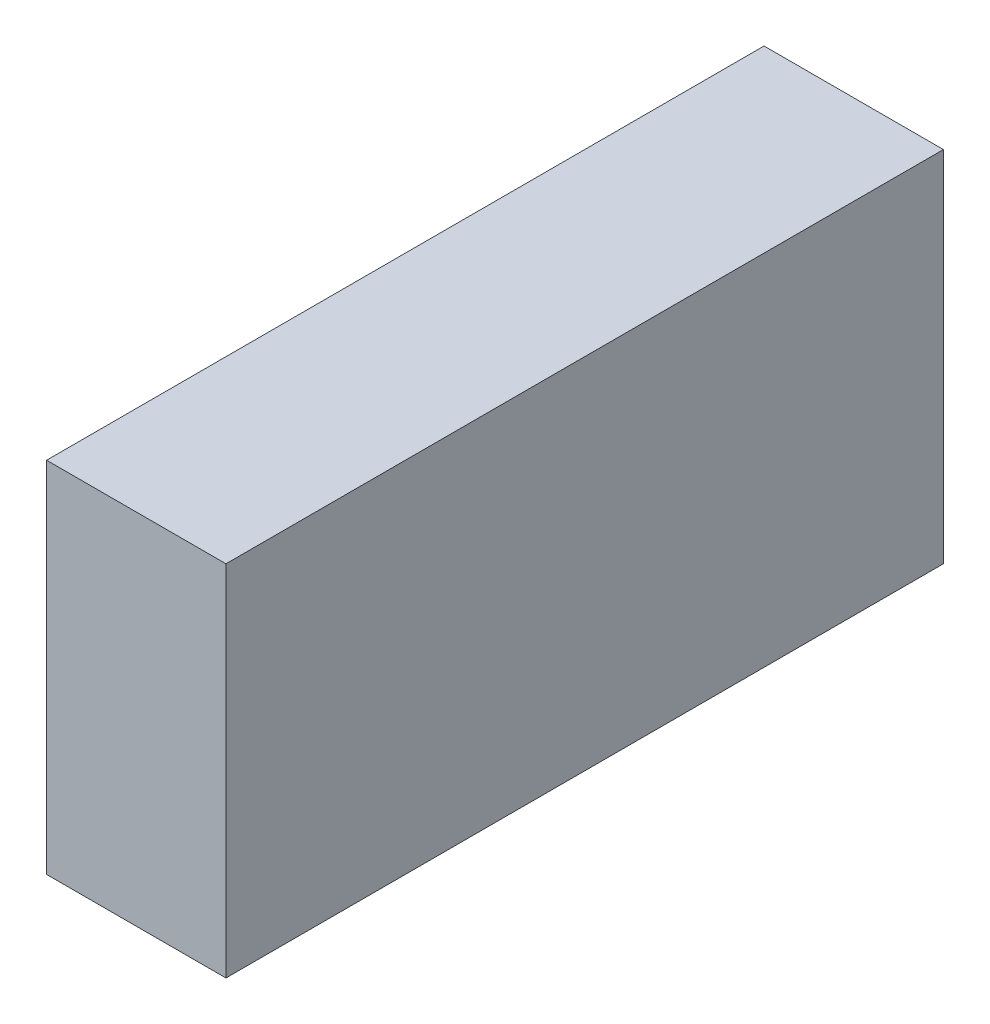
from build123d import *

# Parameters (mm, degrees)
SKETCH1_W           = 40
SKETCH1_H           = 20
BOSS_EXTRUDE1_DEPTH = 5


with BuildPart() as part:
    # Sketch1 → Boss-Extrude1 (new, symmetric)
    with BuildSketch(Plane(origin=(0, 0, 0), x_dir=(0, 0, -1), z_dir=(1, 0, 0))):
        with Locations((20, 10)):
            Rectangle(SKETCH1_W, SKETCH1_H)
    extrude(amount=BOSS_EXTRUDE1_DEPTH, both=True)


solid = part.part
